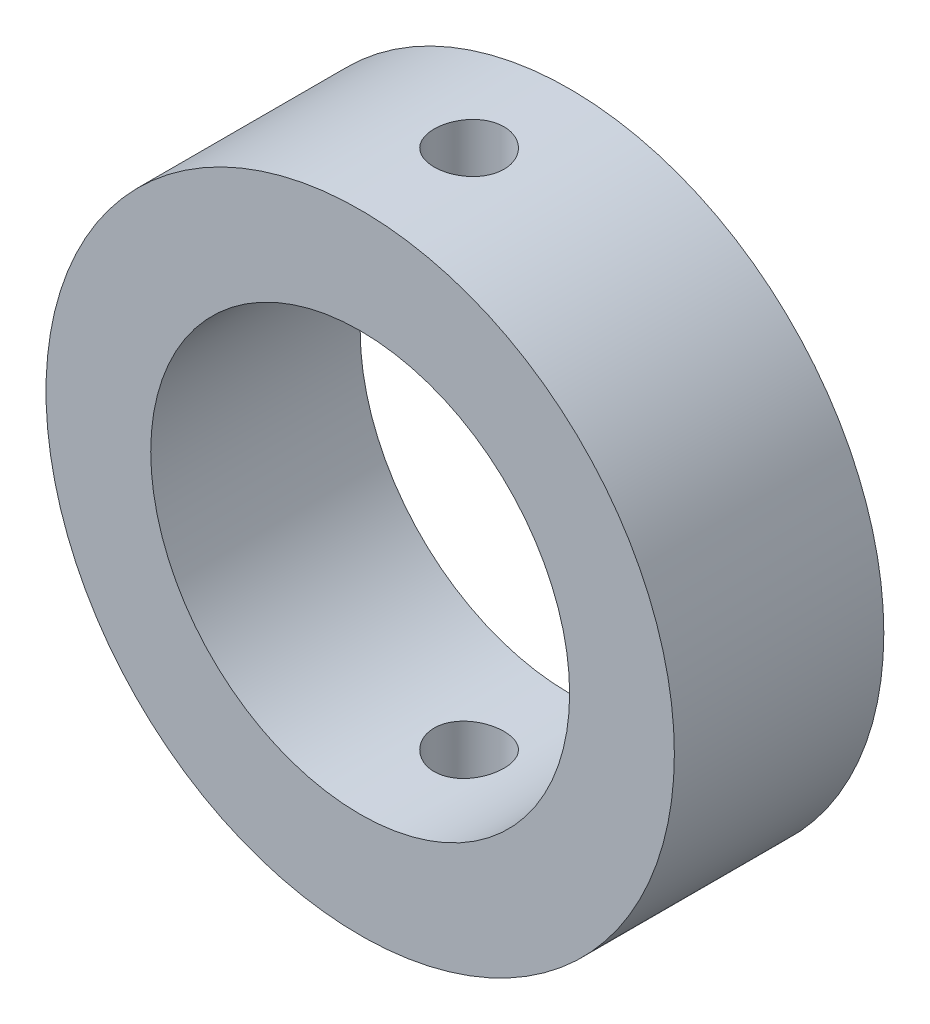
from build123d import *

# Parameters (mm, degrees)
SKETCH2_R           = 22.5
SKETCH2_R_2         = 15
BOSS_EXTRUDE1_DEPTH = 15
SKETCH3_R           = 2.5
CUT_EXTRUDE1_DEPTH  = 50


with BuildPart() as part:
    # Sketch2 → Boss-Extrude1 (new body)
    with BuildSketch(Plane.XY):
        Circle(SKETCH2_R)
        Circle(SKETCH2_R_2, mode=Mode.SUBTRACT)
    extrude(amount=BOSS_EXTRUDE1_DEPTH)

    # Sketch3 → Cut-Extrude1 (cut, symmetric)
    with BuildSketch(Plane(origin=(0, 0, 0), x_dir=(1, 0, 0), z_dir=(0, 1, 0))):
        with Locations(Location((0, -7.201513956, 0), (0, 0, 270))):
            Circle(SKETCH3_R)
    extrude(amount=CUT_EXTRUDE1_DEPTH, both=True, mode=Mode.SUBTRACT)


solid = part.part
